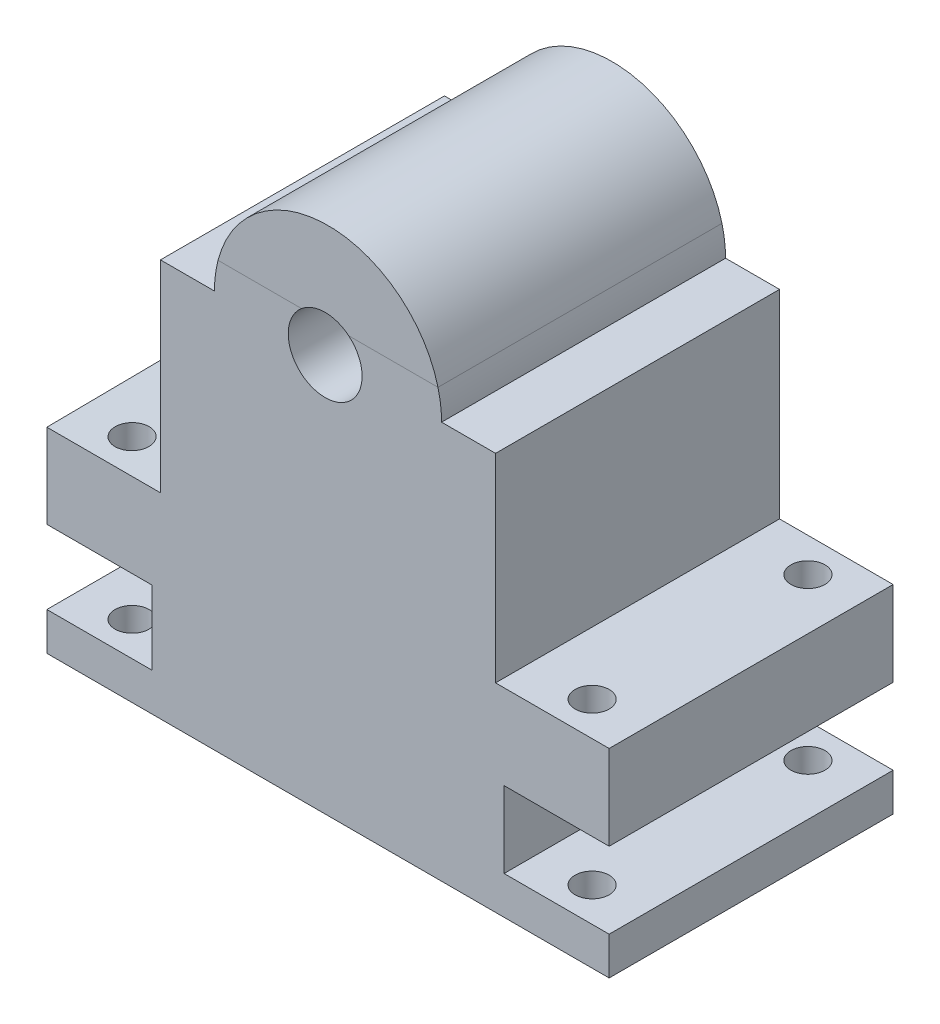
from build123d import *

# Parameters (mm, degrees)
BOSS_EXTRU_1_DEPTH       = 500
ESQUISSE2_W              = 990
ESQUISSE2_H              = 500
BOSS_EXTRU_2_DEPTH       = 250
ENL_V_MAT_EXTRU_6_DEPTH  = 200
ESQUISSE15_W             = 500
ESQUISSE15_H             = 350
ENL_V_MAT_EXTRU_7_DEPTH  = 200
ESQUISSE16_W             = 500
ESQUISSE16_H             = 134.041314403
ENL_V_MAT_EXTRU_8_DEPTH  = 185
ESQUISSE17_W             = 500
ESQUISSE17_H             = 129.824071981
ENL_V_MAT_EXTRU_9_DEPTH  = 185
ESQUISSE18_R             = 30
ENL_V_MAT_EXTRU_10_DEPTH = 450
ESQUISSE19_R             = 65
ENL_V_MAT_EXTRU_11_DEPTH = 500


with BuildPart() as part:
    # Esquisse1 → Boss.-Extru.1 (new body)
    with BuildSketch(Plane.XY):
        with BuildLine():
            Line((0, 0), (990, 0))
            Line((990, 0), (990, 450))
            Line((990, 450), (695, 450))
            ThreePointArc((695, 450), (495, 650), (295, 450))
            Line((295, 450), (0, 450))
            Line((0, 450), (0, 0))
        make_face()
    extrude(amount=BOSS_EXTRU_1_DEPTH)

    # Esquisse2 → Boss.-Extru.2 (add)
    with BuildSketch(Plane.XZ):
        with Locations((495, 250)):
            Rectangle(ESQUISSE2_W, ESQUISSE2_H)
    extrude(amount=BOSS_EXTRU_2_DEPTH)


with BuildPart() as body_2:
    # Fractionner2: the piece on the far side of the plane
    add(part.part)
    split(bisect_by=Plane(origin=(0, 500, 0), x_dir=(0, 0, -1), z_dir=(0, -1, 0)), keep=Keep.BOTTOM)


with BuildPart() as part_1:
    add(part.part)

    # Fractionner2
    split(bisect_by=Plane(origin=(0, 500, 0), x_dir=(0, 0, -1), z_dir=(0, -1, 0)), keep=Keep.TOP)

    # Esquisse14 → Enlèv. mat.-Extru.6 (cut)
    with BuildSketch(Plane.ZY):
        Polygon((500, 94.871649535), (0, 100), (0, 450), (500, 450), align=None)
    extrude(amount=-ENL_V_MAT_EXTRU_6_DEPTH, mode=Mode.SUBTRACT)

    # Esquisse15 → Enlèv. mat.-Extru.7 (cut)
    with BuildSketch(Plane(origin=(990, 0, 0), x_dir=(0, 0, -1), z_dir=(1, 0, 0))):
        with Locations((-250, 275)):
            Rectangle(ESQUISSE15_W, ESQUISSE15_H)
    extrude(amount=-ENL_V_MAT_EXTRU_7_DEPTH, mode=Mode.SUBTRACT)

    # Esquisse16 → Enlèv. mat.-Extru.8 (cut)
    with BuildSketch(Plane(origin=(990, 0, 0), x_dir=(0, 0, -1), z_dir=(1, 0, 0))):
        with Locations((-250, -116.14971871)):
            Rectangle(ESQUISSE16_W, ESQUISSE16_H)
    extrude(amount=-ENL_V_MAT_EXTRU_8_DEPTH, mode=Mode.SUBTRACT)

    # Esquisse17 → Enlèv. mat.-Extru.9 (cut)
    with BuildSketch(Plane.ZY):
        with Locations((250, -118.202021533)):
            Rectangle(ESQUISSE17_W, ESQUISSE17_H)
    extrude(amount=-ENL_V_MAT_EXTRU_9_DEPTH, mode=Mode.SUBTRACT)

    # Esquisse18 → Enlèv. mat.-Extru.10 (cut)
    with BuildSketch(Plane(origin=(0, 100, 0), x_dir=(1, 0, 0), z_dir=(0, 1, 0))):
        with Locations(Location((900, -440, 0), (0, 0, 270))):
            Circle(ESQUISSE18_R)
        with Locations(Location((900, -60, 0), (0, 0, 270))):
            Circle(ESQUISSE18_R)
        with Locations(Location((90, -440, 0), (0, 0, 270))):
            Circle(ESQUISSE18_R)
        with Locations(Location((90, -60, 0), (0, 0, 270))):
            Circle(ESQUISSE18_R)
    extrude(amount=-ENL_V_MAT_EXTRU_10_DEPTH, mode=Mode.SUBTRACT)


with BuildPart() as enl_v_mat_extru_11_tool:
    # Esquisse19 → Enlèv. mat.-Extru.11 (new body)
    with BuildSketch(Plane(origin=(0, 0, 0), x_dir=(-1, 0, 0), z_dir=(0, 0, -1))):
        with Locations((-490, 450)):
            Circle(ESQUISSE19_R)
    extrude(amount=-ENL_V_MAT_EXTRU_11_DEPTH)


with BuildPart() as part_2:
    add(part_1.part)

    # Enlèv. mat.-Extru.11: cut by enl_v_mat_extru_11_tool
    add(enl_v_mat_extru_11_tool.part, mode=Mode.SUBTRACT)


with BuildPart() as body_2_1:
    add(body_2.part)

    # Enlèv. mat.-Extru.11: cut by enl_v_mat_extru_11_tool
    add(enl_v_mat_extru_11_tool.part, mode=Mode.SUBTRACT)


solid = Compound([part_2.part, body_2_1.part])
